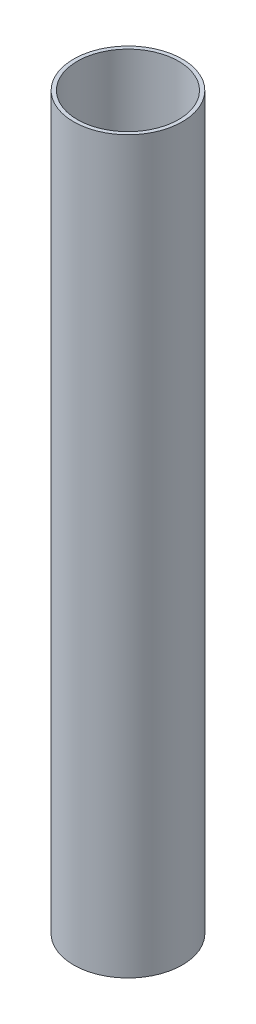
from build123d import *

# Parameters (mm, degrees)
SKETCH1_R           = 20.8
SKETCH1_R_2         = 19.3675
BOSS_EXTRUDE1_DEPTH = 279.4


with BuildPart() as part:
    # Sketch1 → Boss-Extrude1 (new body)
    with BuildSketch(Plane(origin=(0, 0, 0), x_dir=(1, 0, 0), z_dir=(0, 1, 0))):
        with Locations(Location((0, 0, 0), (0, 0, 270))):
            Circle(SKETCH1_R)
        with Locations(Location((0, 0, 0), (0, 0, 270))):
            Circle(SKETCH1_R_2, mode=Mode.SUBTRACT)
    extrude(amount=BOSS_EXTRUDE1_DEPTH)


solid = part.part
